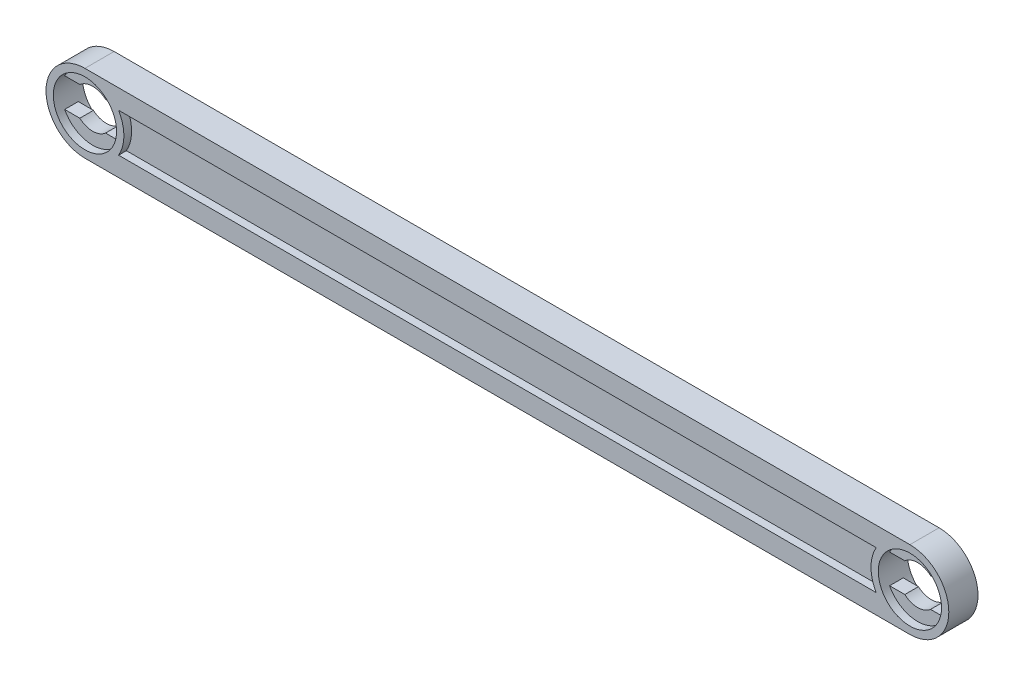
from build123d import *

# Parameters (mm, degrees)
EXTRUDE_1_DEPTH        = 3
CUT_EXTRUDE_1_REACH    = 90.941
SKETCH_3_R             = 3.25
CUT_EXTRUDE_2_DEPTH    = 0.8
CUT_EXTRUDE_START      = -2.2
SKETCH_3_2_R           = 3.25
CUT_EXTRUDE_3_DEPTH    = 0.8
PATTERN_LINEAR_1_COUNT = 2
PATTERN_LINEAR_1_PITCH = 84.8
CUT_EXTRUDE_4_DEPTH    = 0.8
SKETCH_5_W             = 76.8
SKETCH_5_H             = 4
CUT_EXTRUDE_5_DEPTH    = 0.8


with BuildPart() as part:
    # 草图1 → 凸台-拉伸1 (new body)
    with BuildSketch(Plane.XY):
        with BuildLine():
            Line((0, 4), (84.8, 4))
            ThreePointArc((84.8, 4), (88.8, 0), (84.8, -4))
            Line((84.8, -4), (0, -4))
            ThreePointArc((0, -4), (-4, 0), (0, 4))
        make_face()
    extrude(amount=-EXTRUDE_1_DEPTH)

    # 草图2 → 切除-拉伸1 (cut, up to next)
    with BuildSketch(Plane.XY, mode=Mode.PRIVATE) as cut_extrude_1_sk1:
        with BuildLine():
            Line((1.322875656, -1.5), (2.883140649, -1.5))
            ThreePointArc((2.883140649, -1.5), (3.25, 0), (2.883140649, 1.5))
            Line((2.883140649, 1.5), (1.322875656, 1.5))
            ThreePointArc((1.322875656, 1.5), (0, 2), (-1.322875656, 1.5))
            Line((-1.322875656, 1.5), (-2.883140649, 1.5))
            ThreePointArc((-2.883140649, 1.5), (-3.25, 0), (-2.883140649, -1.5))
            Line((-2.883140649, -1.5), (-1.322875656, -1.5))
            ThreePointArc((-1.322875656, -1.5), (0, -2), (1.322875656, -1.5))
        make_face()
    cut_extrude_1_tool1 = extrude(cut_extrude_1_sk1.sketch, amount=-CUT_EXTRUDE_1_REACH, mode=Mode.PRIVATE) & part.part
    cut_extrude_1 = cut_extrude_1_tool1.solids().sort_by_distance((0, 0, 0))[0]
    add(cut_extrude_1, mode=Mode.SUBTRACT)

    # 草图3 → 切除-拉伸2 (cut)
    with BuildSketch(Plane.XY):
        Circle(SKETCH_3_R)
    cut_extrude_2 = extrude(amount=-CUT_EXTRUDE_2_DEPTH, mode=Mode.SUBTRACT)

    # 草图3<2> → 切除-拉伸3 (cut)
    with BuildSketch(Plane.XY.offset(CUT_EXTRUDE_START)):
        Circle(SKETCH_3_2_R)
    cut_extrude_3 = extrude(amount=-CUT_EXTRUDE_3_DEPTH, mode=Mode.SUBTRACT)

    # 阵列(线性)1: 切除-拉伸1, 切除-拉伸2, 切除-拉伸3 ×2
    with Locations(*[(i * PATTERN_LINEAR_1_PITCH, 0, 0) for i in range(1, PATTERN_LINEAR_1_COUNT)]):
        add(cut_extrude_1, mode=Mode.SUBTRACT)
        add(cut_extrude_2, mode=Mode.SUBTRACT)
        add(cut_extrude_3, mode=Mode.SUBTRACT)

    # 草图4 → 切除-拉伸4 (cut)
    with BuildSketch(Plane.XY):
        with BuildLine():
            Line((3.464101615, 2), (81.335898385, 2))
            ThreePointArc((81.335898385, 2), (80.8, 0), (81.335898385, -2))
            Line((81.335898385, -2), (3.464101615, -2))
            ThreePointArc((3.464101615, -2), (4, 0), (3.464101615, 2))
        make_face()
    extrude(amount=-CUT_EXTRUDE_4_DEPTH, mode=Mode.SUBTRACT)

    # 草图5 → 切除-拉伸5 (cut)
    with BuildSketch(Plane(origin=(0, 0, -3), x_dir=(-1, 0, 0), z_dir=(0, 0, -1))):
        with Locations((-42.4, 0)):
            Rectangle(SKETCH_5_W, SKETCH_5_H)
    extrude(amount=-CUT_EXTRUDE_5_DEPTH, mode=Mode.SUBTRACT)


solid = part.part
